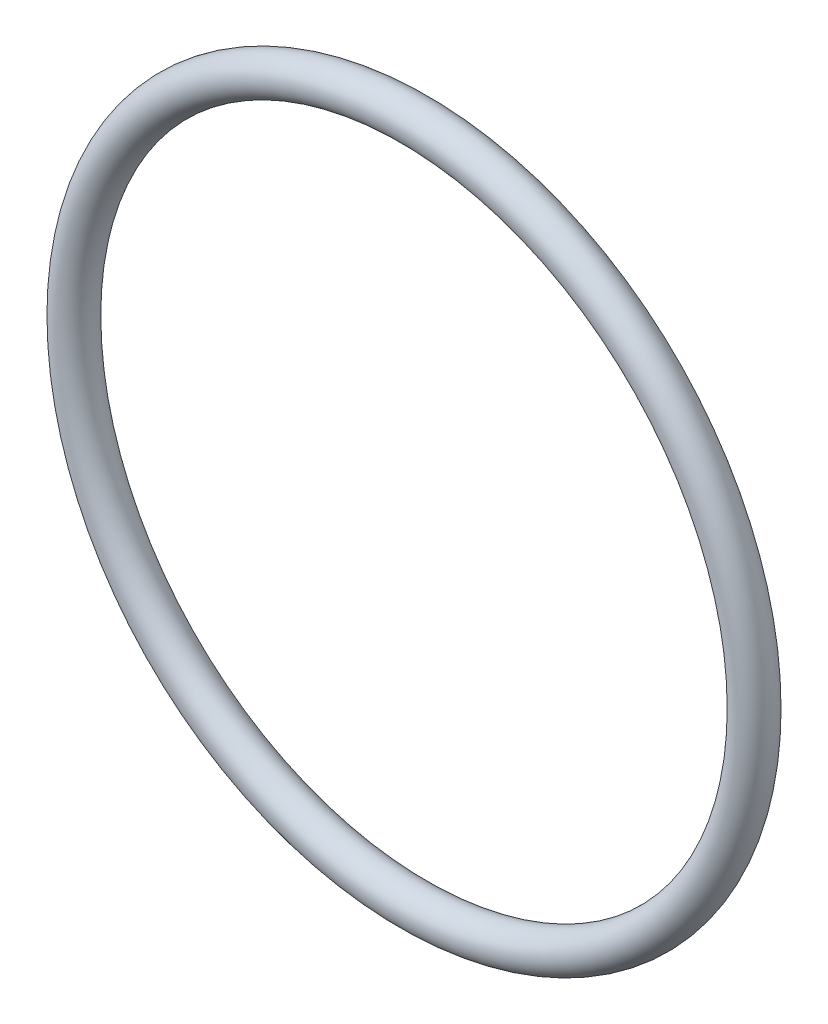
from build123d import *

# Parameters (mm, degrees)
SKETCH1_R = 0.889


with BuildPart() as part:
    # Sketch1 → Revolve1 (revolve)
    with BuildSketch(Plane(origin=(0, 0, 0), x_dir=(0, 0, -1), z_dir=(1, 0, 0)), mode=Mode.PRIVATE) as revolve1_sk:
        with Locations((0, 15.875)):
            Circle(SKETCH1_R)
    revolve(revolve1_sk.sketch.rotate(Axis((0, 0, 151.155192532), (0, 0, -1)), 90), axis=Axis((0, 0, 151.155192532), (0, 0, -1)))


solid = part.part
